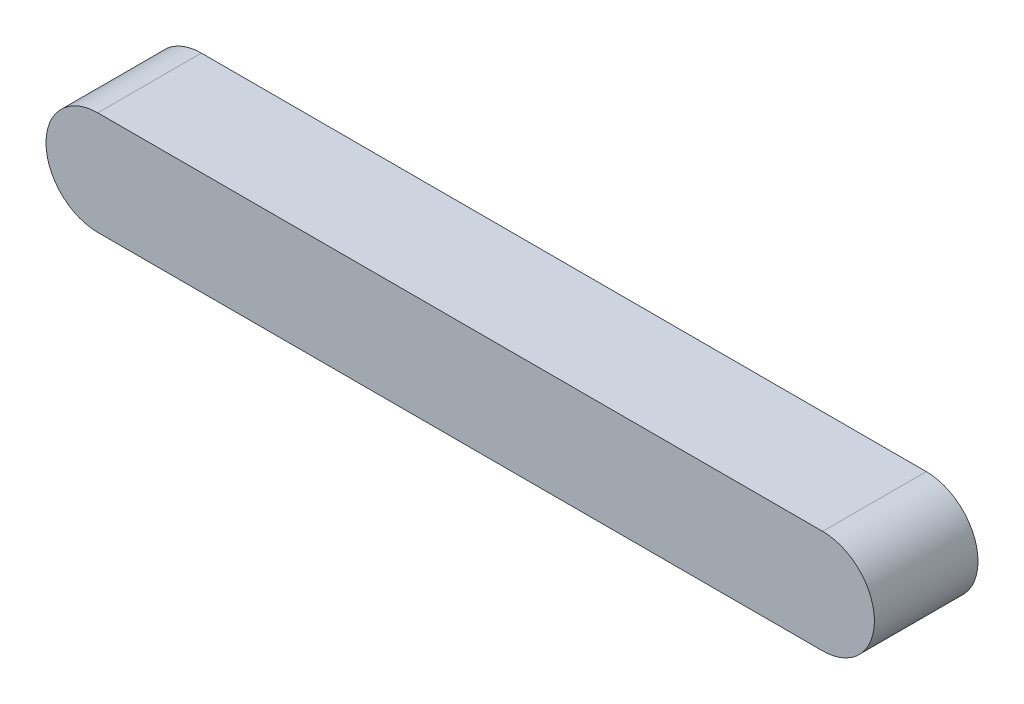
from build123d import *

# Parameters (mm, degrees)
SKETCH1_W         = 25.4
SKETCH1_H         = 3.175
EXTRUDE1_DEPTH    = 3.175
SKETCH2_OUTSIDE_W = 32.558
SKETCH2_OUTSIDE_H = 10.333
EXTRUDE2_DEPTH    = 59.025242352


with BuildPart() as part:
    # Sketch1 → Extrude1 (new body)
    with BuildSketch(Plane(origin=(0, 0, 0), x_dir=(1, 0, 0), z_dir=(0, 1, 0))):
        Rectangle(SKETCH1_W, SKETCH1_H)
    extrude(amount=-EXTRUDE1_DEPTH)

    # Sketch2 outside → Extrude2 (cut, through all)
    with BuildSketch(Plane(origin=(44.45, 6.35, 1.5875), x_dir=(-1, 0, 0), z_dir=(0, 0, -1))):
        with Locations((44.45, -7.9375)):
            Rectangle(SKETCH2_OUTSIDE_W, SKETCH2_OUTSIDE_H)
        with BuildLine():
            Line((33.3375, -6.35), (55.5625, -6.35))
            ThreePointArc((55.5625, -6.35), (57.15, -7.9375), (55.5625, -9.525))
            Line((55.5625, -9.525), (33.3375, -9.525))
            ThreePointArc((33.3375, -9.525), (31.75, -7.9375), (33.3375, -6.35))
        make_face(mode=Mode.SUBTRACT)
    extrude(amount=EXTRUDE2_DEPTH, mode=Mode.SUBTRACT)


solid = part.part
